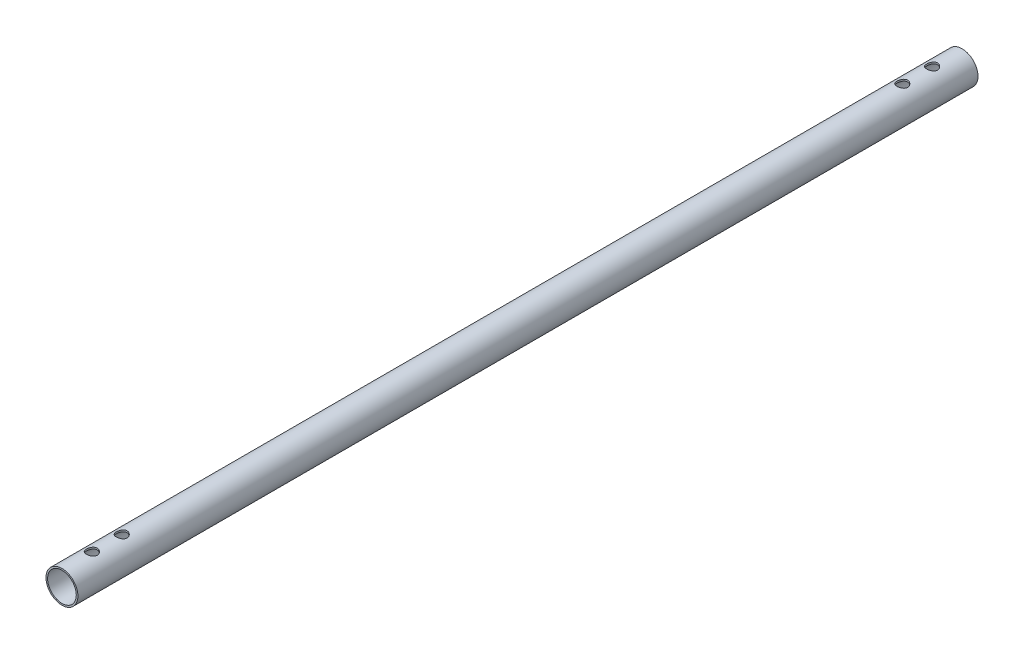
from build123d import *

# Parameters (mm, degrees)
SKETCH1_R               = 13.35
SKETCH1_R_2             = 11.7
BOSS_EXTRUDE1_DEPTH     = 376.5
CUT_EXTRUDE1_DEPTH      = 377.97306933
CUT_EXTRUDE1_DEPTH_BACK = 377.97306933
SKETCH2_R               = 4.5
SKETCH3_R               = 12
CUT_EXTRUDE2_DEPTH      = 70
CUT_EXTRUDE3_START      = -70
SKETCH4_R               = 12
CUT_EXTRUDE3_DEPTH      = 70


with BuildPart() as part:
    # Sketch1 → Boss-Extrude1 (new, symmetric)
    with BuildSketch(Plane.XY):
        Circle(SKETCH1_R)
        Circle(SKETCH1_R_2, mode=Mode.SUBTRACT)
    extrude(amount=BOSS_EXTRUDE1_DEPTH, both=True)

    # Sketch2 → Cut-Extrude1 (cut, two sides: drawn at the far end of the back side and taken through both)
    with BuildSketch(Plane(origin=(0, 0, 0), x_dir=(1, 0, 0), z_dir=(0, 1, 0)).offset(-CUT_EXTRUDE1_DEPTH_BACK)):
        with Locations(Location((0, -351.5, 0), (0, 0, 270))):
            Circle(SKETCH2_R)
        with Locations(Location((0, -326.5, 0), (0, 0, 270))):
            Circle(SKETCH2_R)
        with Locations(Location((0, 351.5, 0), (0, 0, 270))):
            Circle(SKETCH2_R)
        with Locations(Location((0, 326.5, 0), (0, 0, 270))):
            Circle(SKETCH2_R)
    extrude(amount=CUT_EXTRUDE1_DEPTH + CUT_EXTRUDE1_DEPTH_BACK, mode=Mode.SUBTRACT)

    # Sketch3 → Cut-Extrude2 (cut)
    with BuildSketch(Plane(origin=(0, 0, -376.5), x_dir=(-1, 0, 0), z_dir=(0, 0, -1))):
        Circle(SKETCH3_R)
    extrude(amount=-CUT_EXTRUDE2_DEPTH, mode=Mode.SUBTRACT)

    # Sketch4 → Cut-Extrude3 (cut)
    with BuildSketch(Plane.XY.offset(376.5).offset(CUT_EXTRUDE3_START)):
        with Locations(Location((0, 0, 0), (0, 0, 180))):
            Circle(SKETCH4_R)
    extrude(amount=CUT_EXTRUDE3_DEPTH, mode=Mode.SUBTRACT)


solid = part.part
